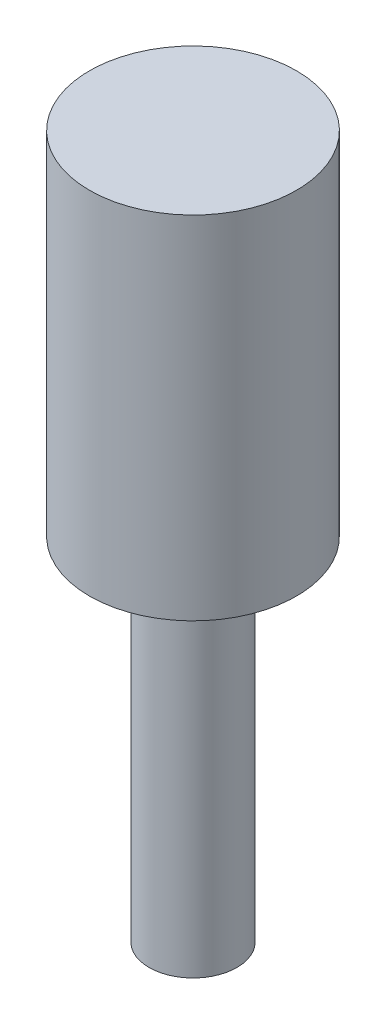
from build123d import *

# Parameters (mm, degrees)
SKETCH1_R           = 3.175
BOSS_EXTRUDE1_DEPTH = 25.4
SKETCH2_R           = 7.483568298
BOSS_EXTRUDE2_DEPTH = 25.4


with BuildPart() as part:
    # Sketch1 → Boss-Extrude1 (new body)
    with BuildSketch(Plane(origin=(0, 0, 0), x_dir=(1, 0, 0), z_dir=(0, 1, 0))):
        with Locations(Location((0, 0, 0), (0, 0, 270))):
            Circle(SKETCH1_R)
    extrude(amount=BOSS_EXTRUDE1_DEPTH)

    # Sketch2 → Boss-Extrude2 (add)
    with BuildSketch(Plane(origin=(0, 25.4, 0), x_dir=(1, 0, 0), z_dir=(0, 1, 0))):
        with Locations(Location((0, 0, 0), (0, 0, 270))):
            Circle(SKETCH2_R)
    extrude(amount=BOSS_EXTRUDE2_DEPTH)


solid = part.part
